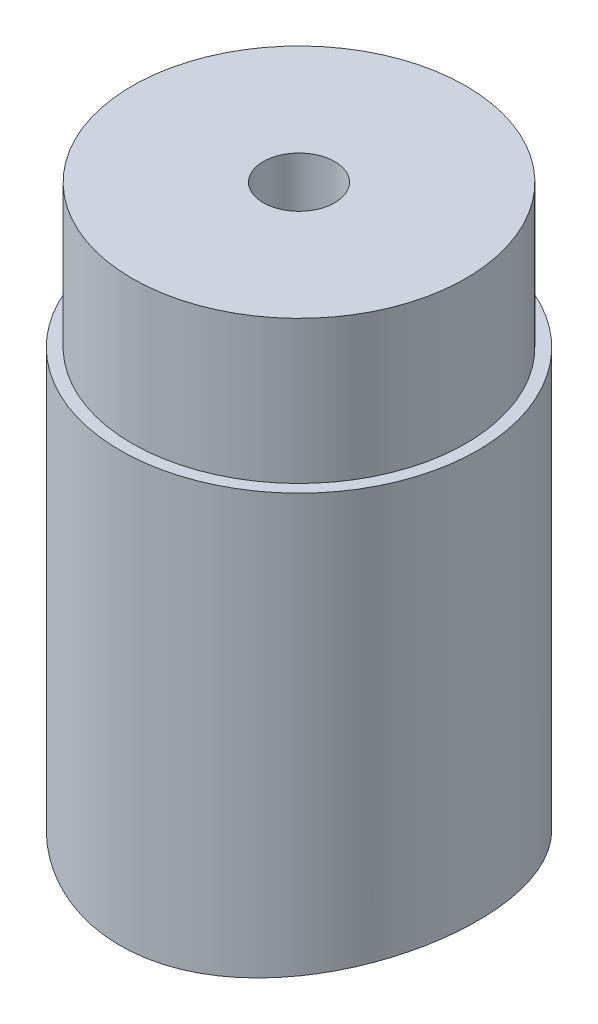
from build123d import *

# Parameters (mm, degrees)
CORTAR_EXTRUIR1_DEPTH      = 27.239283527
CORTAR_EXTRUIR1_DEPTH_BACK = 27.239283527


with BuildPart() as part:
    # Croquis1 → Revolución1 (revolve)
    with BuildSketch(Plane.XY, mode=Mode.PRIVATE) as revoluci_n1_sk:
        Polygon((7, 24), (7, 18), (7.5, 18), (7.5, 0), (1.5, 0), (1.5, 24), align=None)
    revolve(revoluci_n1_sk.sketch.rotate(Axis((0, 0, 0), (0, 1, 0)), 90), axis=Axis((0, 0, 0), (0, 1, 0)))

    # Croquis2 → Cortar-Extruir1 (cut, two sides: drawn at the far end of the back side and taken through both)
    with BuildSketch(Plane(origin=(0, 0, 0), x_dir=(0, 0, -1), z_dir=(1, 0, 0)).offset(-CORTAR_EXTRUIR1_DEPTH_BACK)):
        with BuildLine():
            Line((-7.5, 0), (7.5, 0))
            ThreePointArc((7.5, 0), (0, 0.905882918), (-7.5, 0))
        make_face()
    extrude(amount=CORTAR_EXTRUIR1_DEPTH + CORTAR_EXTRUIR1_DEPTH_BACK, mode=Mode.SUBTRACT)


solid = part.part
